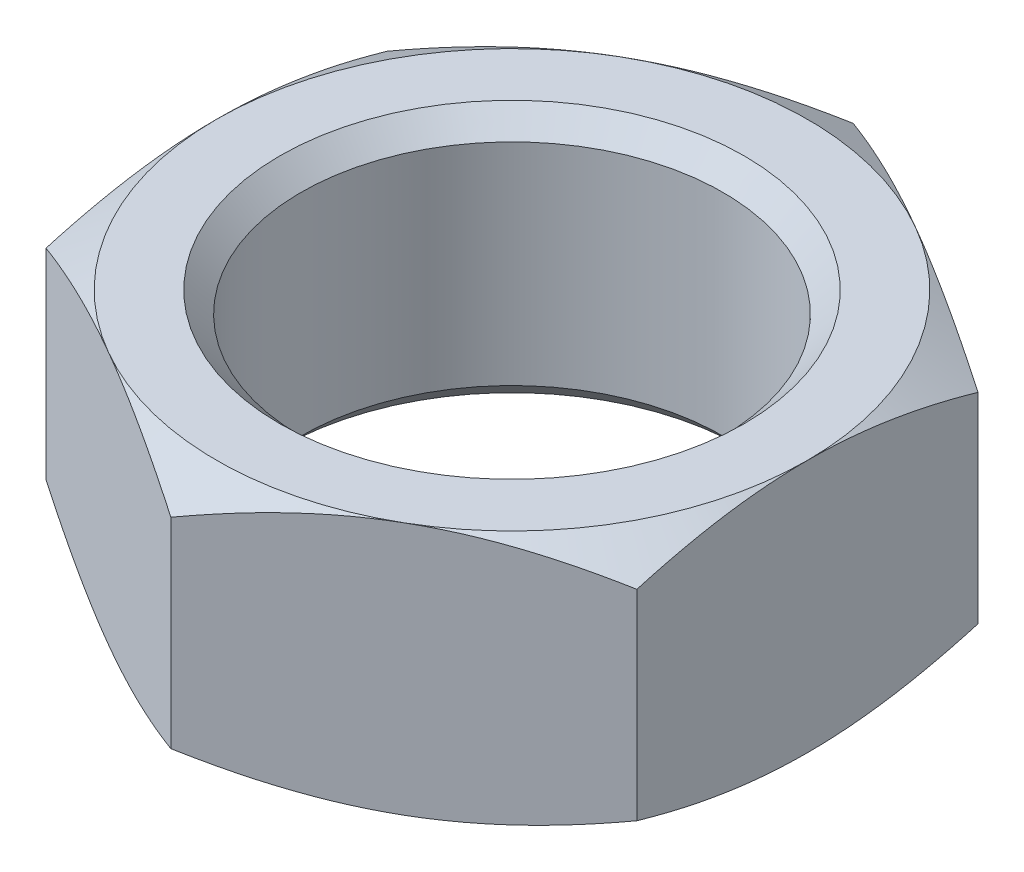
from build123d import *

# Parameters (mm, degrees)
BOSS_EXTRUDE1_DEPTH     = 6
SKETCH5_OUTSIDE_W       = 80.454
SKETCH5_OUTSIDE_H       = 84.786
SKETCH5_OUTSIDE_R       = 14
CUT_EXTRUDE1_DEPTH      = 12
CUT_EXTRUDE1_DRAFT      = -60
MIRROR1_COPY_1_SKETCH_W = 80.454
MIRROR1_COPY_1_SKETCH_H = 84.786
MIRROR1_COPY_1_SKETCH_R = 14
MIRROR1_COPY_1_DEPTH    = 12
MIRROR1_COPY_1_DRAFT    = -60
SKETCH6_R               = 10
CUT_EXTRUDE2_DEPTH      = 25.522098877
CHAMFER1_SIZE           = 1
CHAMFER2_SIZE           = 1


with BuildPart() as part:
    # Sketch3 → Boss-Extrude1 (new, symmetric)
    with BuildSketch(Plane(origin=(0, 0, 0), x_dir=(1, 0, 0), z_dir=(0, 1, 0))):
        Polygon((0, 16.165807537), (-14, 8.082903769), (-14, -8.082903769), (0, -16.165807537), (14, -8.082903769), (14, 8.082903769), align=None)
    extrude(amount=BOSS_EXTRUDE1_DEPTH, both=True)


with BuildPart() as cut_extrude1_tool:
    # Sketch5 outside → Cut-Extrude1 (with draft: the straight prism first)
    with BuildSketch(Plane(origin=(0, 6, 0), x_dir=(1, 0, 0), z_dir=(0, 1, 0))):
        Rectangle(SKETCH5_OUTSIDE_W, SKETCH5_OUTSIDE_H)
        Circle(SKETCH5_OUTSIDE_R, mode=Mode.SUBTRACT)
    extrude(amount=-CUT_EXTRUDE1_DEPTH)
    # Cut-Extrude1: the draft: its side faces are tilted about the plane it starts from
    cut_extrude1_sides = [cut_extrude1_tool.faces().sort_by_distance(p)[0] for p in [
        (0, 0, 42.393),
        (40.227, 0, 0),
        (0, 0, -42.393),
        (-40.227, 0, 0),
        (-14, 0, 0),
    ]]
    draft(cut_extrude1_sides, Plane(origin=(0, 6, 0), x_dir=(1, 0, 0), z_dir=(0, 1, 0)), CUT_EXTRUDE1_DRAFT)


with BuildPart() as part_1:
    add(part.part)

    # Cut-Extrude1: cut by cut_extrude1_tool
    add(cut_extrude1_tool.part, mode=Mode.SUBTRACT)


with BuildPart() as mirror1_copy_1_tool:
    # Mirror1 copy 1 sketch → Mirror1 copy 1 (with draft: the straight prism first)
    with BuildSketch(Plane.XZ.offset(6)):
        Rectangle(MIRROR1_COPY_1_SKETCH_W, MIRROR1_COPY_1_SKETCH_H)
        Circle(MIRROR1_COPY_1_SKETCH_R, mode=Mode.SUBTRACT)
    extrude(amount=-MIRROR1_COPY_1_DEPTH)
    # Mirror1 copy 1: the draft: its side faces are tilted about the plane it starts from
    mirror1_copy_1_sides = [mirror1_copy_1_tool.faces().sort_by_distance(p)[0] for p in [
        (0, 0, 42.393),
        (40.227, 0, 0),
        (0, 0, -42.393),
        (-40.227, 0, 0),
        (-14, 0, 0),
    ]]
    draft(mirror1_copy_1_sides, Plane.XZ.offset(6), MIRROR1_COPY_1_DRAFT)


with BuildPart() as part_2:
    add(part_1.part)

    # Mirror1 copy 1: cut by mirror1_copy_1_tool
    add(mirror1_copy_1_tool.part, mode=Mode.SUBTRACT)

    # Sketch6 → Cut-Extrude2 (cut, through all)
    with BuildSketch(Plane(origin=(0, 6, 0), x_dir=(1, 0, 0), z_dir=(0, 1, 0))):
        with Locations(Location((0, 0, 0), (0, 0, 270))):
            Circle(SKETCH6_R)
    extrude(amount=-CUT_EXTRUDE2_DEPTH, mode=Mode.SUBTRACT)

    # Chamfer1
    chamfer1_edges = [part_2.edges().sort_by_distance(p)[0] for p in [
        (0, 6, -10),
    ]]
    chamfer(chamfer1_edges, length=CHAMFER1_SIZE)

    # Chamfer2
    chamfer2_edges = [part_2.edges().sort_by_distance(p)[0] for p in [
        (0, -6, -10),
    ]]
    chamfer(chamfer2_edges, length=CHAMFER2_SIZE)


solid = part_2.part
